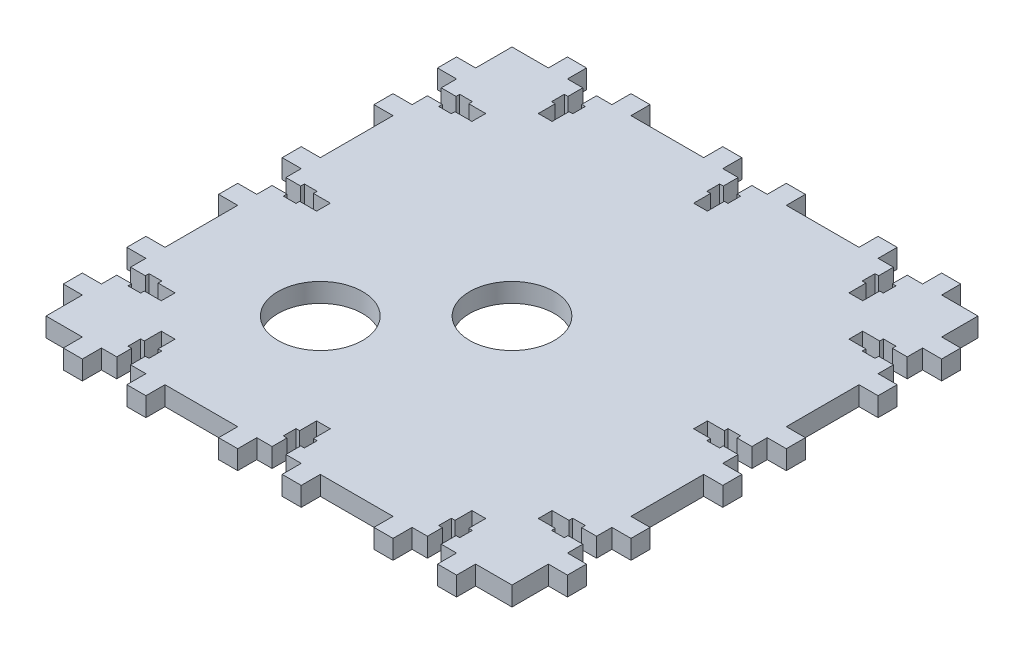
from build123d import *

# Parameters (mm, degrees)
SKETCH1_R           = 20
BOSS_EXTRUDE1_DEPTH = 9


with BuildPart() as part:
    # Sketch1 → Boss-Extrude1 (new body)
    with BuildSketch(Plane(origin=(0, 0, 0), x_dir=(1, 0, 0), z_dir=(0, 1, 0))):
        Polygon((-110, -110), (-92.833333333, -110), (-92.833333333, -119), (-83.833333333, -119), (-83.833333333, -110), (-76.583333333, -110), (-76.583333333, -103), (-78.308333333, -103), (-78.308333333, -97), (-76.583333333, -97), (-76.583333333, -89), (-70.083333333, -89), (-70.083333333, -97), (-68.358333333, -97), (-68.358333333, -103), (-70.083333333, -103), (-70.083333333, -110), (-62.833333333, -110), (-62.833333333, -119), (-53.833333333, -119), (-53.833333333, -110), (-19.5, -110), (-19.5, -119), (-10.5, -119), (-10.5, -110), (-3.25, -110), (-3.25, -103), (-4.975, -103), (-4.975, -97), (-3.25, -97), (-3.25, -89), (3.25, -89), (3.25, -97), (4.975, -97), (4.975, -103), (3.25, -103), (3.25, -110), (10.5, -110), (10.5, -119), (19.5, -119), (19.5, -110), (53.833333333, -110), (53.833333333, -119), (62.833333333, -119), (62.833333333, -110), (70.083333333, -110), (70.083333333, -103), (68.358333333, -103), (68.358333333, -97), (70.083333333, -97), (70.083333333, -89), (76.583333333, -89), (76.583333333, -97), (78.308333333, -97), (78.308333333, -103), (76.583333333, -103), (76.583333333, -110), (83.833333333, -110), (83.833333333, -119), (92.833333333, -119), (92.833333333, -110), (110, -110), (110, -92.833333333), (119, -92.833333333), (119, -83.833333333), (110, -83.833333333), (110, -76.583333333), (103, -76.583333333), (103, -78.308333333), (97, -78.308333333), (97, -76.583333333), (89, -76.583333333), (89, -70.083333333), (97, -70.083333333), (97, -68.358333333), (103, -68.358333333), (103, -70.083333333), (110, -70.083333333), (110, -62.833333333), (119, -62.833333333), (119, -53.833333333), (110, -53.833333333), (110, -19.5), (119, -19.5), (119, -10.5), (110, -10.5), (110, -3.25), (103, -3.25), (103, -4.975), (97, -4.975), (97, -3.25), (89, -3.25), (89, 3.25), (97, 3.25), (97, 4.975), (103, 4.975), (103, 3.25), (110, 3.25), (110, 10.5), (119, 10.5), (119, 19.5), (110, 19.5), (110, 53.833333333), (119, 53.833333333), (119, 62.833333333), (110, 62.833333333), (110, 70.083333333), (103, 70.083333333), (103, 68.358333333), (97, 68.358333333), (97, 70.083333333), (89, 70.083333333), (89, 76.583333333), (97, 76.583333333), (97, 78.308333333), (103, 78.308333333), (103, 76.583333333), (110, 76.583333333), (110, 83.833333333), (119, 83.833333333), (119, 92.833333333), (110, 92.833333333), (110, 110), (92.833333333, 110), (92.833333333, 119), (83.833333333, 119), (83.833333333, 110), (76.583333333, 110), (76.583333333, 103), (78.308333333, 103), (78.308333333, 97), (76.583333333, 97), (76.583333333, 89), (70.083333333, 89), (70.083333333, 97), (68.358333333, 97), (68.358333333, 103), (70.083333333, 103), (70.083333333, 110), (62.833333333, 110), (62.833333333, 119), (53.833333333, 119), (53.833333333, 110), (19.5, 110), (19.5, 119), (10.5, 119), (10.5, 110), (3.25, 110), (3.25, 103), (4.975, 103), (4.975, 97), (3.25, 97), (3.25, 89), (-3.25, 89), (-3.25, 97), (-4.975, 97), (-4.975, 103), (-3.25, 103), (-3.25, 110), (-10.5, 110), (-10.5, 119), (-19.5, 119), (-19.5, 110), (-53.833333333, 110), (-53.833333333, 119), (-62.833333333, 119), (-62.833333333, 110), (-70.083333333, 110), (-70.083333333, 103), (-68.358333333, 103), (-68.358333333, 97), (-70.083333333, 97), (-70.083333333, 89), (-76.583333333, 89), (-76.583333333, 97), (-78.308333333, 97), (-78.308333333, 103), (-76.583333333, 103), (-76.583333333, 110), (-83.833333333, 110), (-83.833333333, 119), (-92.833333333, 119), (-92.833333333, 110), (-110, 110), (-110, 92.833333333), (-119, 92.833333333), (-119, 83.833333333), (-110, 83.833333333), (-110, 76.583333333), (-103, 76.583333333), (-103, 78.308333333), (-97, 78.308333333), (-97, 76.583333333), (-89, 76.583333333), (-89, 70.083333333), (-97, 70.083333333), (-97, 68.358333333), (-103, 68.358333333), (-103, 70.083333333), (-110, 70.083333333), (-110, 62.833333333), (-119, 62.833333333), (-119, 53.833333333), (-110, 53.833333333), (-110, 19.5), (-119, 19.5), (-119, 10.5), (-110, 10.5), (-110, 3.25), (-103, 3.25), (-103, 4.975), (-97, 4.975), (-97, 3.25), (-89, 3.25), (-89, -3.25), (-97, -3.25), (-97, -4.975), (-103, -4.975), (-103, -3.25), (-110, -3.25), (-110, -10.5), (-119, -10.5), (-119, -19.5), (-110, -19.5), (-110, -53.833333333), (-119, -53.833333333), (-119, -62.833333333), (-110, -62.833333333), (-110, -70.083333333), (-103, -70.083333333), (-103, -68.358333333), (-97, -68.358333333), (-97, -70.083333333), (-89, -70.083333333), (-89, -76.583333333), (-97, -76.583333333), (-97, -78.308333333), (-103, -78.308333333), (-103, -76.583333333), (-110, -76.583333333), (-110, -83.833333333), (-119, -83.833333333), (-119, -92.833333333), (-110, -92.833333333), align=None)
        with Locations(Location((-45.254833996, -45.254833996, 0), (0, 0, 270))):
            Circle(SKETCH1_R, mode=Mode.SUBTRACT)
        with Locations(Location((0, 0, 0), (0, 0, 270))):
            Circle(SKETCH1_R, mode=Mode.SUBTRACT)
    extrude(amount=BOSS_EXTRUDE1_DEPTH)


solid = part.part
